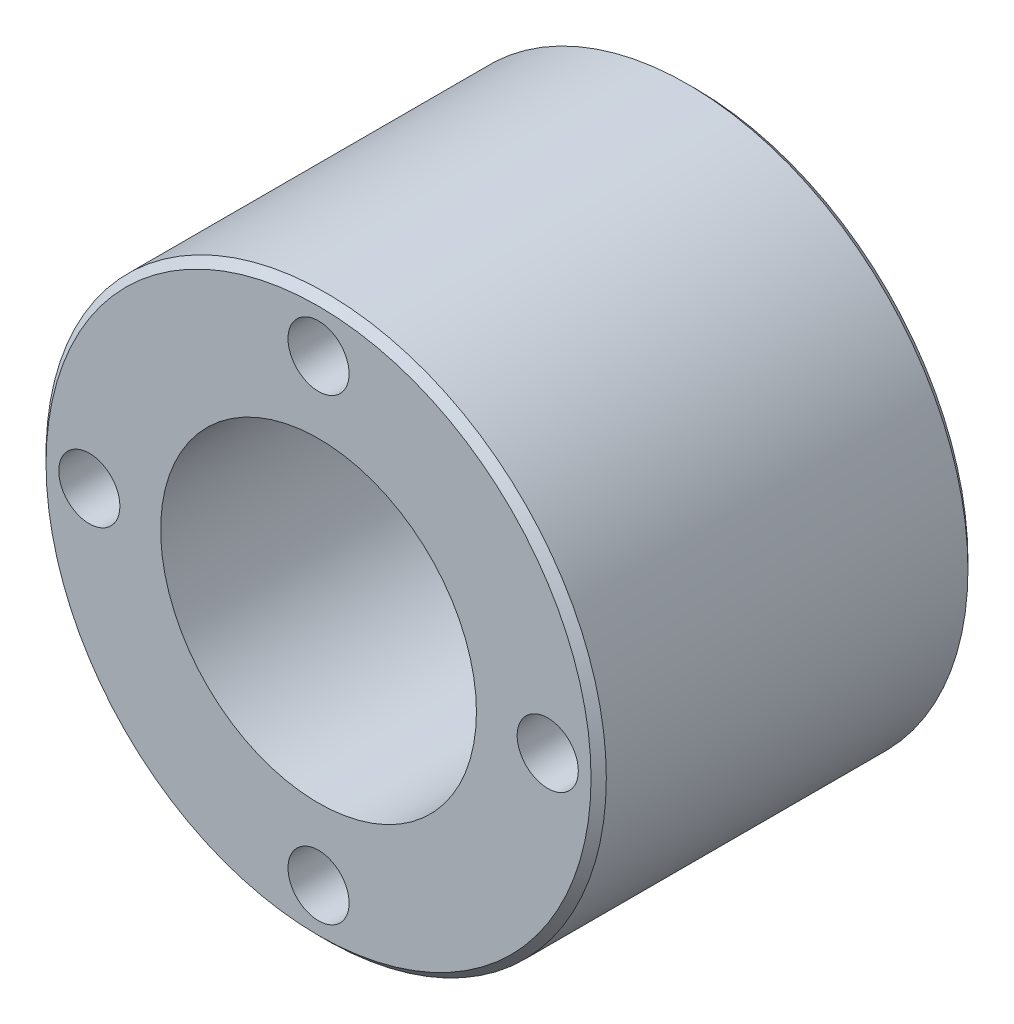
from build123d import *

# Parameters (mm, degrees)
SKETCH1_R           = 11
SKETCH1_R_2         = 6.2
BOSS_EXTRUDE1_DEPTH = 14.8
SKETCH2_R           = 1.2
CUT_EXTRUDE1_DEPTH  = 14.8
CHAMFER1_SIZE       = 0.3


with BuildPart() as part:
    # Sketch1 → Boss-Extrude1 (new body)
    with BuildSketch(Plane.XY):
        Circle(SKETCH1_R)
        Circle(SKETCH1_R_2, mode=Mode.SUBTRACT)
    extrude(amount=BOSS_EXTRUDE1_DEPTH)

    # Sketch2 → Cut-Extrude1 (cut)
    with BuildSketch(Plane.XY.offset(14.8)):
        with Locations((0, 9)):
            Circle(SKETCH2_R)
        with Locations((9, 0)):
            Circle(SKETCH2_R)
        with Locations((0, -9)):
            Circle(SKETCH2_R)
        with Locations((-9, 0)):
            Circle(SKETCH2_R)
    extrude(amount=-CUT_EXTRUDE1_DEPTH, mode=Mode.SUBTRACT)

    # Chamfer1
    chamfer1_edges = [part.edges().sort_by_distance(p)[0] for p in [
        (-11, 0, 0),
        (-11, 0, 14.8),
    ]]
    chamfer(chamfer1_edges, length=CHAMFER1_SIZE)


solid = part.part
